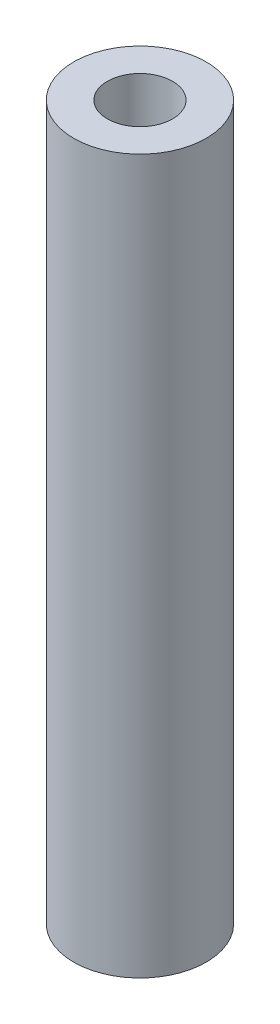
from build123d import *

# Parameters (mm, degrees)
SKETCH1_R           = 3.25
SKETCH1_R_2         = 1.6
BOSS_EXTRUDE1_DEPTH = 35


with BuildPart() as part:
    # Sketch1 → Boss-Extrude1 (new body)
    with BuildSketch(Plane(origin=(0, 0, 0), x_dir=(1, 0, 0), z_dir=(0, 1, 0))):
        with Locations(Location((0, 0, 0), (0, 0, 270))):
            Circle(SKETCH1_R)
        with Locations(Location((0, 0, 0), (0, 0, 270))):
            Circle(SKETCH1_R_2, mode=Mode.SUBTRACT)
    extrude(amount=BOSS_EXTRUDE1_DEPTH)


solid = part.part
